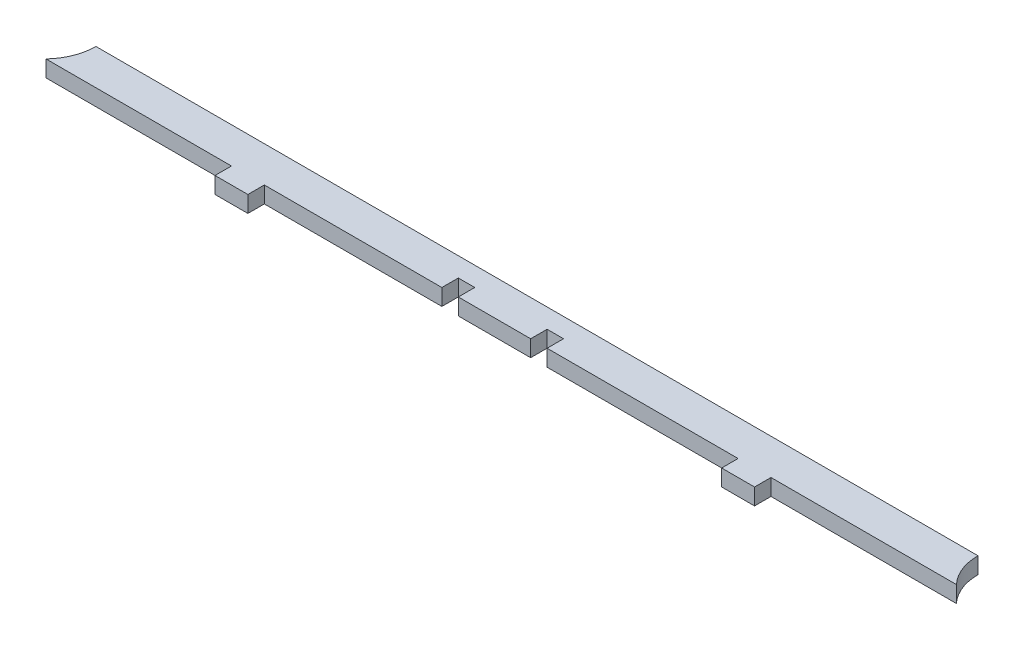
from build123d import *

# Parameters (mm, degrees)
SKETCH1_W           = 10
SKETCH1_H           = 5
BOSS_EXTRUDE1_DEPTH = 2.5
CUT_EXTRUDE2_REACH  = 141.432
SKETCH2_W           = 5
SKETCH2_H           = 5


with BuildPart() as part:
    # Sketch1 → Boss-Extrude1 (new, symmetric)
    with BuildSketch(Plane(origin=(0, 0, 0), x_dir=(-1, 0, 0), z_dir=(0, 1, 0))):
        with BuildLine():
            ThreePointArc((138.434966494, 10.875), (135.24177294, 5.848962219), (134.125, 0))
            Line((134.125, 0), (-134.125, 0))
            ThreePointArc((-134.125, 0), (-135.24177294, 5.848962219), (-138.434966494, 10.875))
            Line((-138.434966494, 10.875), (138.434966494, 10.875))
        make_face()
        with Locations((-77.04, 13.375)):
            Rectangle(SKETCH1_W, SKETCH1_H)
        with Locations((77.04, 13.375)):
            Rectangle(SKETCH1_W, SKETCH1_H)
    extrude(amount=BOSS_EXTRUDE1_DEPTH, both=True)

    # Sketch2 → Cut-Extrude2 (cut, up to next)
    with BuildSketch(Plane(origin=(0, 2.5, 0), x_dir=(-1, 0, 0), z_dir=(0, 1, 0)), mode=Mode.PRIVATE) as cut_extrude2_sk1:
        with Locations((-11.455033506, 8.375)):
            Rectangle(SKETCH2_W, SKETCH2_H)
    cut_extrude2_tool1 = extrude(cut_extrude2_sk1.sketch, amount=-CUT_EXTRUDE2_REACH, mode=Mode.PRIVATE) & part.part
    # Sketch2 → Cut-Extrude2 (cut, up to next)
    with BuildSketch(Plane(origin=(0, 2.5, 0), x_dir=(-1, 0, 0), z_dir=(0, 1, 0)), mode=Mode.PRIVATE) as cut_extrude2_sk2:
        with Locations((15.544966494, 8.375)):
            Rectangle(SKETCH2_W, SKETCH2_H)
    cut_extrude2_tool2 = extrude(cut_extrude2_sk2.sketch, amount=-CUT_EXTRUDE2_REACH, mode=Mode.PRIVATE) & part.part
    add(cut_extrude2_tool1.solids().sort_by_distance((11.455034, 2.5, 8.375))[0], mode=Mode.SUBTRACT)
    add(cut_extrude2_tool2.solids().sort_by_distance((-15.544966, 2.5, 8.375))[0], mode=Mode.SUBTRACT)


solid = part.part
